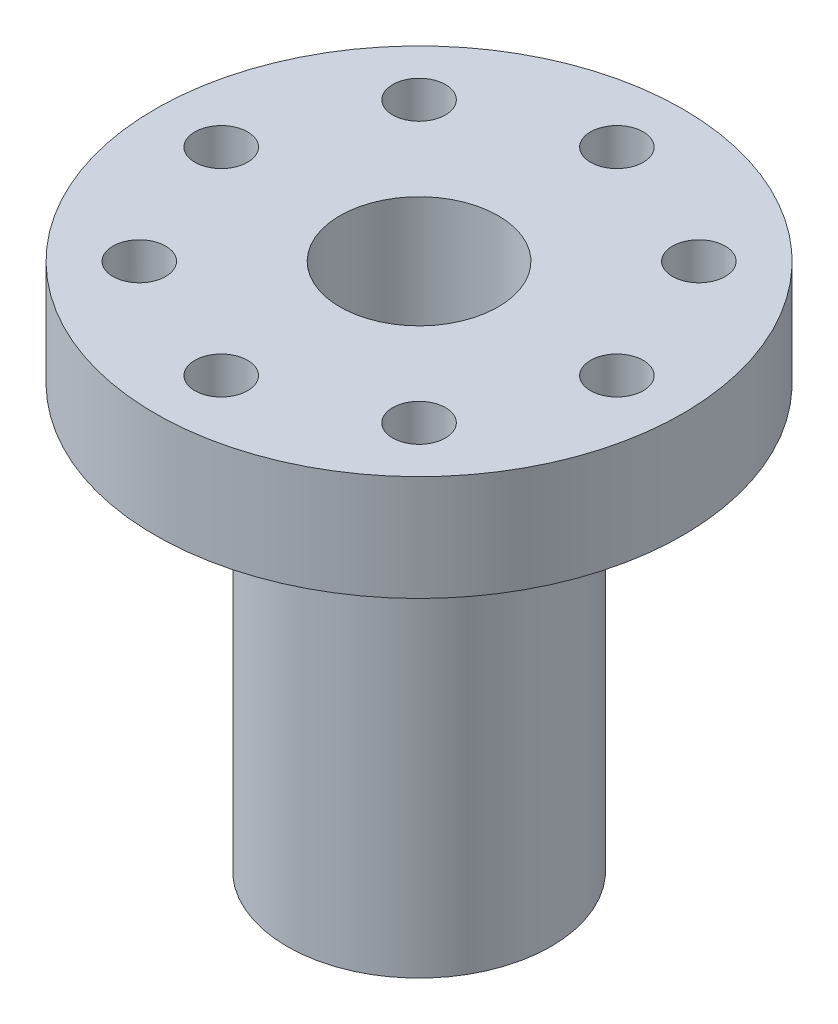
from build123d import *

# Parameters (mm, degrees)
SKETCH2_R          = 2.54
CUT_EXTRUDE1_DEPTH = 3.5052
SKETCH4_R          = 1.27
CUT_EXTRUDE2_DEPTH = 32.108519733
CIRPATTERN1_COUNT  = 8


with BuildPart() as part:
    # Sketch1 → Revolve1 (revolve)
    with BuildSketch(Plane.XY, mode=Mode.PRIVATE) as revolve1_sk:
        Polygon((3.81, 25.4), (3.81, 4.572), (0.635, 4.572), (0.635, 0), (6.35, 0), (6.35, 20.32), (12.7, 20.32), (12.7, 25.4), align=None)
    revolve(revolve1_sk.sketch.rotate(Axis((0, 0, 0), (0, 1, 0)), 90), axis=Axis((0, 0, 0), (0, 1, 0)))

    # Sketch2 → Cut-Extrude1 (cut)
    with BuildSketch(Plane.XZ):
        with Locations(Location((0, 0, 0), (0, 0, 270))):
            Circle(SKETCH2_R)
    extrude(amount=-CUT_EXTRUDE1_DEPTH, mode=Mode.SUBTRACT)

    # Sketch4 → Cut-Extrude2 (cut, through all)
    with BuildSketch(Plane(origin=(0, 25.4, 0), x_dir=(1, 0, 0), z_dir=(0, 1, 0))):
        with Locations(Location((0, 9.525, 0), (0, 0, 270))):
            Circle(SKETCH4_R)
    cut_extrude2 = extrude(amount=-CUT_EXTRUDE2_DEPTH, mode=Mode.SUBTRACT)

    # CirPattern1: Cut-Extrude2 ×8 about axis
    cirpattern1_axis = Axis((0, 0, 0), (0, 1, 0))
    for i in range(1, CIRPATTERN1_COUNT):
        add(cut_extrude2.rotate(cirpattern1_axis, i * 360 / CIRPATTERN1_COUNT), mode=Mode.SUBTRACT)


solid = part.part
